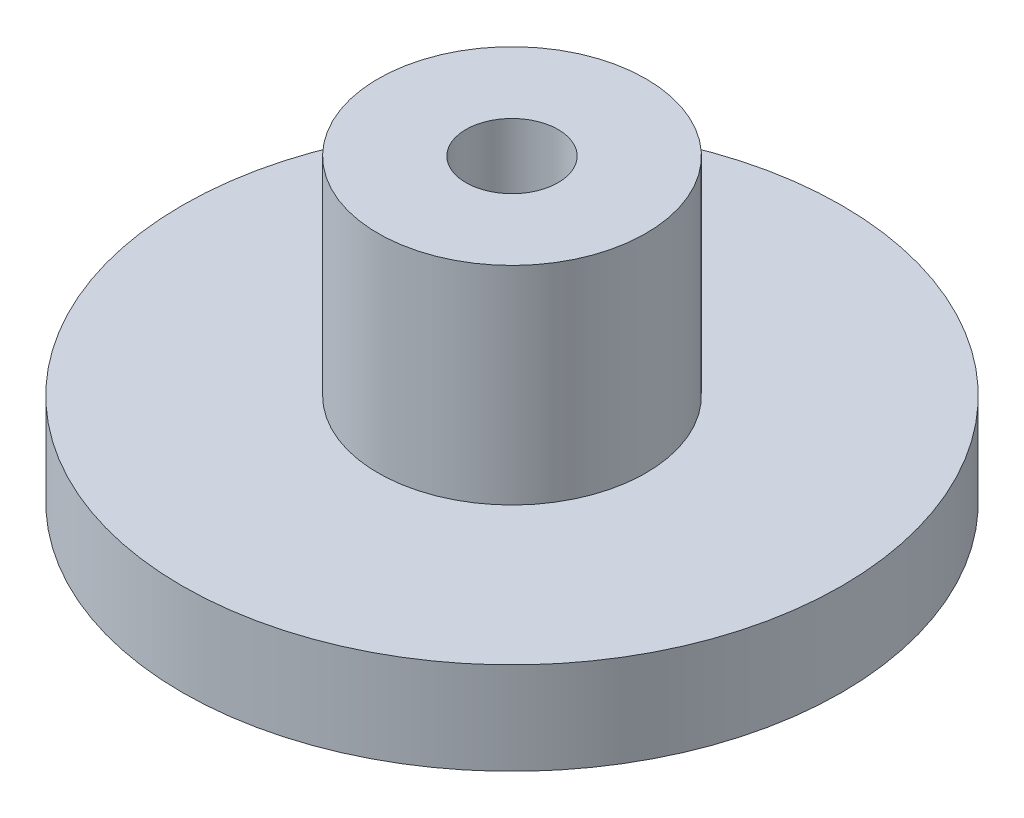
from build123d import *


with BuildPart() as part:
    # Sketch1 → 14 and 35 (revolve)
    with BuildSketch(Plane.XY, mode=Mode.PRIVATE) as f_14_and_35_sk:
        Polygon((1, 6.5), (1, 0), (2.5, 0), (2.5, 0.6), (5.5, 0.6), (5.5, 0), (7.1501, 0), (7.1501, 2), (2.905125, 2), (2.905125, 6.5), align=None)
    revolve(f_14_and_35_sk.sketch.rotate(Axis((0, 0, 0), (0, 1, 0)), 90), axis=Axis((0, 0, 0), (0, 1, 0)))


solid = part.part
